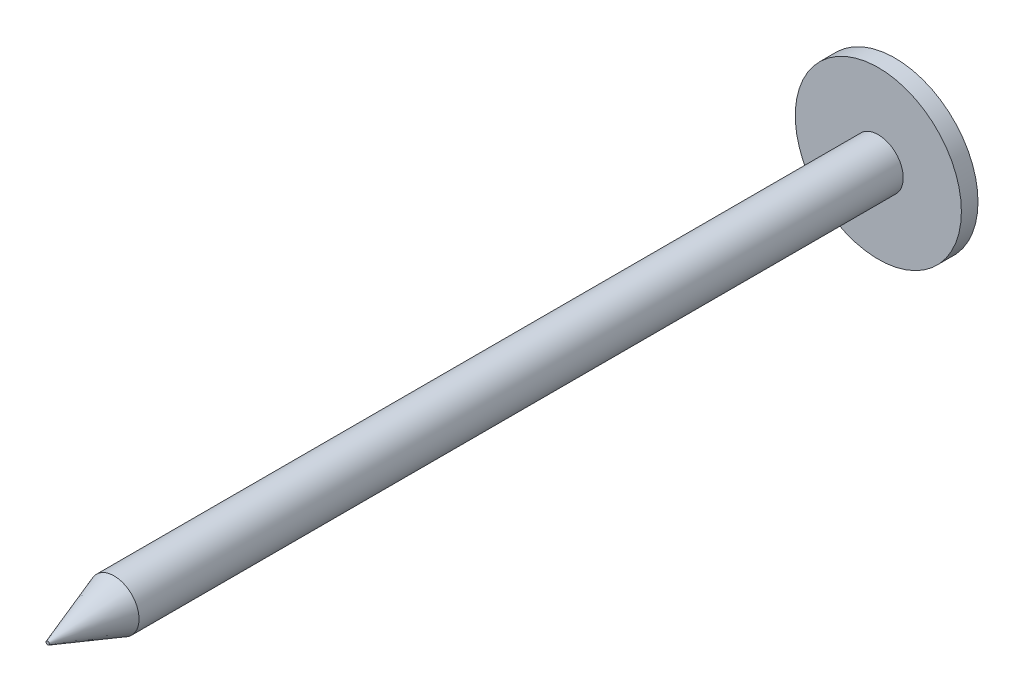
from build123d import *

# Parameters (mm, degrees)
SKETCH1_R      = 2.5
EXTRUDE1_DEPTH = 0.5
SKETCH2_R      = 0.75
EXTRUDE2_DEPTH = 25
CHAMFER1_SIZE  = 2
CHAMFER1_SIZE2 = 0.7


with BuildPart() as part:
    # Sketch1 → Extrude1 (new body)
    with BuildSketch(Plane.XY):
        Circle(SKETCH1_R)
    extrude(amount=EXTRUDE1_DEPTH)

    # Sketch2 → Extrude2 (add)
    with BuildSketch(Plane.XY.offset(0.5)):
        Circle(SKETCH2_R)
    extrude(amount=EXTRUDE2_DEPTH)

    # Chamfer1
    chamfer1_edges = [part.edges().sort_by_distance(p)[0] for p in [
        (-0.75, 0, 25.5),
    ]]
    chamfer1_side = [part.faces().sort_by_distance(p)[0] for p in [
        (-0.75, 0, 13),
    ]]
    chamfer(chamfer1_edges, length=CHAMFER1_SIZE, length2=CHAMFER1_SIZE2, reference=chamfer1_side[0])


solid = part.part
